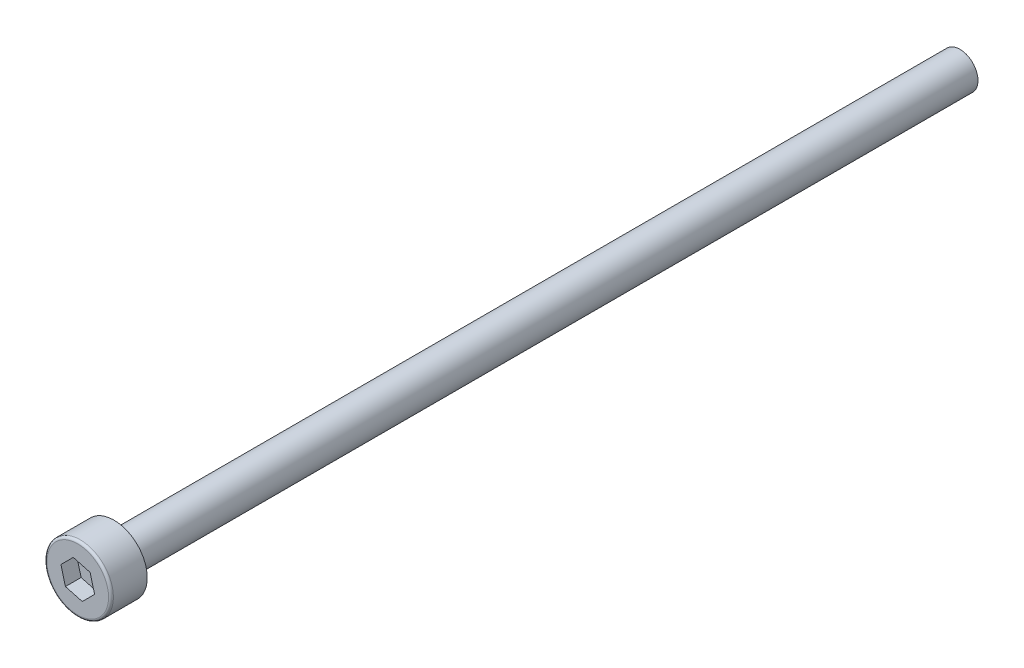
from build123d import *

# Parameters (mm, degrees)
SKETCH_1_R          = 2.75
EXTRUDE_1_DEPTH     = 3
CUT_EXTRUDE_1_DEPTH = 1.3
SKETCH_3_R          = 1.5
EXTRUDE_2_DEPTH     = 70
FILLET_1_R          = 0.2


with BuildPart() as part:
    # 草图1 → 凸台-拉伸1 (new body)
    with BuildSketch(Plane.XY):
        Circle(SKETCH_1_R)
    extrude(amount=EXTRUDE_1_DEPTH)

    # 草图2 → 切除-拉伸1 (cut)
    with BuildSketch(Plane.XY.offset(3)):
        Polygon((-1.020620726, -1.020620726), (0.373573113, -1.39419384), (1.39419384, -0.373573113), (1.020620726, 1.020620726), (-0.373573113, 1.39419384), (-1.39419384, 0.373573113), align=None)
    extrude(amount=-CUT_EXTRUDE_1_DEPTH, mode=Mode.SUBTRACT)

    # 草图3 → 凸台-拉伸2 (add)
    with BuildSketch(Plane(origin=(0, 0, 0), x_dir=(-1, 0, 0), z_dir=(0, 0, -1))):
        with Locations(Location((0, 0, 0), (0, 0, 180))):
            Circle(SKETCH_3_R)
    extrude(amount=EXTRUDE_2_DEPTH)

    # 圆角1
    fillet_1_edges = [part.edges().sort_by_distance(p)[0] for p in [
        (-2.75, 0, 3),
    ]]
    fillet(fillet_1_edges, radius=FILLET_1_R)


solid = part.part
